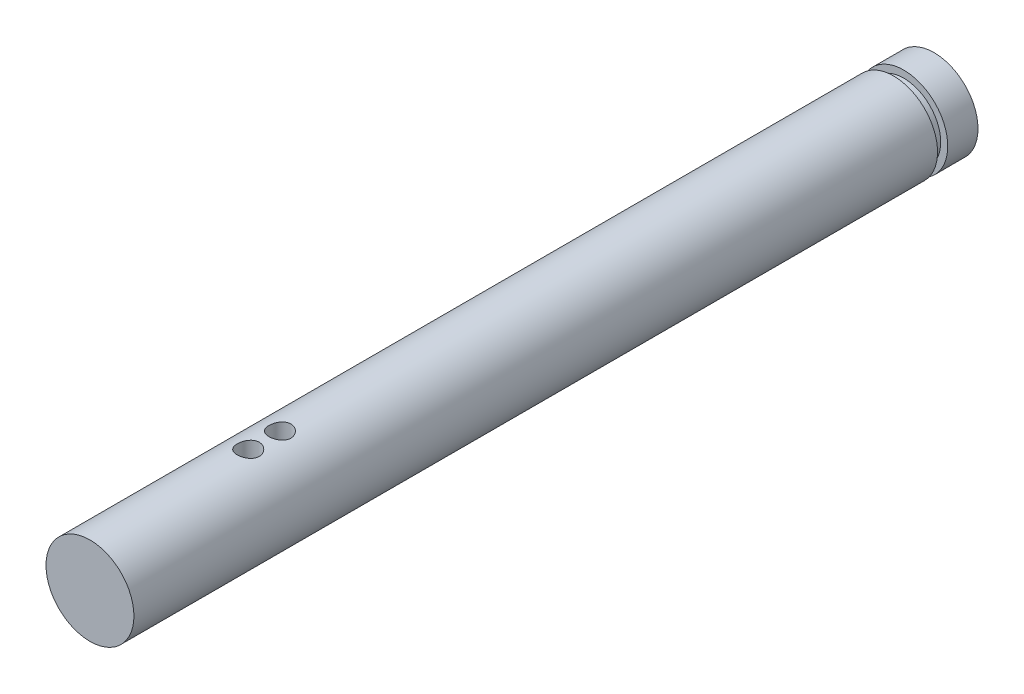
from build123d import *

# Parameters (mm, degrees)
SKETCH1_R               = 3.175
BOSS_EXTRUDE1_DEPTH     = 35.56
SKETCH3_W               = 0.508
SKETCH3_H               = 0.7366
SKETCH5_R               = 3.175
BOSS_EXTRUDE2_DEPTH     = 25.4
CUT_EXTRUDE1_DEPTH      = 62.1251409
CUT_EXTRUDE1_DEPTH_BACK = 62.1251409
SKETCH4_R               = 0.79375


with BuildPart() as part:
    # Sketch1 → Boss-Extrude1 (new body)
    with BuildSketch(Plane.XY):
        Circle(SKETCH1_R)
    extrude(amount=BOSS_EXTRUDE1_DEPTH)

    # Sketch3 → Cut-Revolve3 (revolve, cut)
    with BuildSketch(Plane(origin=(0, 0, 0), x_dir=(1, 0, 0), z_dir=(0, 1, 0)), mode=Mode.PRIVATE) as cut_revolve3_sk:
        with Locations((2.921, -2.5527)):
            Rectangle(SKETCH3_W, SKETCH3_H)
    revolve(cut_revolve3_sk.sketch.rotate(Axis((0, 0, 0), (0, 0, 1)), 180), axis=Axis((0, 0, 0), (0, 0, 1)), mode=Mode.SUBTRACT)

    # Sketch5 → Boss-Extrude2 (add)
    with BuildSketch(Plane.XY.offset(35.56)):
        with Locations(Location((0, 0, 0), (0, 0, 180))):
            Circle(SKETCH5_R)
    extrude(amount=BOSS_EXTRUDE2_DEPTH)

    # Sketch4 → Cut-Extrude1 (cut, two sides: drawn at the far end of the back side and taken through both)
    with BuildSketch(Plane(origin=(0, 0, 0), x_dir=(1, 0, 0), z_dir=(0, 1, 0)).offset(-CUT_EXTRUDE1_DEPTH_BACK)):
        with Locations(Location((0, -47.244, 0), (0, 0, 270))):
            Circle(SKETCH4_R)
        with Locations(Location((0, -49.53, 0), (0, 0, 270))):
            Circle(SKETCH4_R)
    extrude(amount=CUT_EXTRUDE1_DEPTH + CUT_EXTRUDE1_DEPTH_BACK, mode=Mode.SUBTRACT)


solid = part.part
